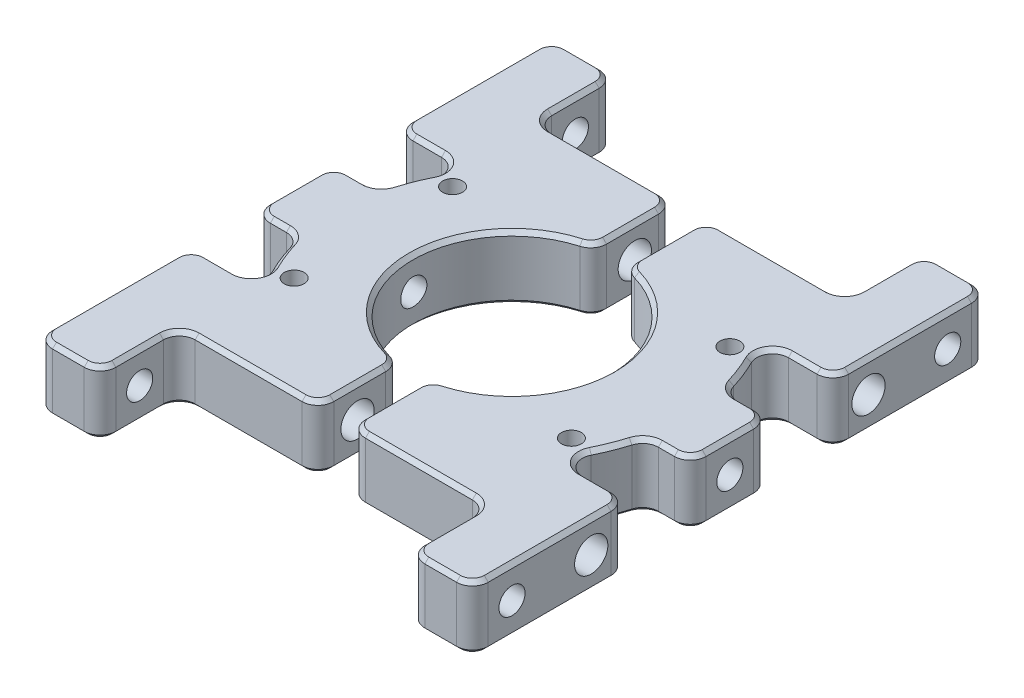
from build123d import *

# Parameters (mm, degrees)
EXTRUDE_1_DEPTH     = 4
EXTRUDE_1_2_DEPTH   = 4
SKETCH_7_W          = 8
SKETCH_7_H          = 65
EXTRUDE_2_DEPTH     = 8
SKETCH_8_R          = 2.1
SKETCH_8_R_2        = 1.5
CUT_EXTRUDE_2_DEPTH = 65.00976488
SKETCH_11_R         = 1.5
CUT_EXTRUDE_3_DEPTH = 65.009764972
SKETCH_12_R         = 1
CUT_EXTRUDE_5_DEPTH = 44.318587317
FILLET_1_R          = 2
FILLET_2_R          = 2
HOLE_WIZARD_M4_3_D  = 3.3
HOLE_WIZARD_M3_1_D  = 2.5
CHAMFER_1_SIZE      = 0.5
CHAMFER_2_SIZE      = 0.5


with BuildPart() as part:
    # 草图1 → 凸台-拉伸1 (new, symmetric)
    with BuildSketch(Plane(origin=(0, 0, 0), x_dir=(1, 0, 0), z_dir=(0, 1, 0))):
        with BuildLine():
            Line((-27.5, 22.5), (-2, 22.5))
            Line((-2, 22.5), (-2, 12.338962679))
            ThreePointArc((-2, 12.338962679), (-12.5, 0), (-2, -12.338962679))
            Line((-2, -12.338962679), (-2, -22.5))
            Line((-2, -22.5), (-27.5, -22.5))
            Line((-27.5, -22.5), (-27.5, 22.5))
        make_face()
    extrude(amount=EXTRUDE_1_DEPTH, both=True)



with BuildPart() as body_2:
    # 草图1 → Extrude 1 2 (new, symmetric)
    with BuildSketch(Plane(origin=(0, 0, 0), x_dir=(1, 0, 0), z_dir=(0, 1, 0))):
        with BuildLine():
            Line((27.5, 22.5), (27.5, -22.5))
            Line((27.5, -22.5), (2, -22.5))
            Line((2, -22.5), (2, -12.338962679))
            ThreePointArc((2, -12.338962679), (12.5, 0), (2, 12.338962679))
            Line((2, 12.338962679), (2, 22.5))
            Line((2, 22.5), (27.5, 22.5))
        make_face()
    extrude(amount=EXTRUDE_1_2_DEPTH, both=True)


with BuildPart() as part_1:
    add(part.part)

    add(body_2.part)  # 凸台-拉伸2 merges body 2
    # 草图7 → 凸台-拉伸2 (add)
    with BuildSketch(Plane(origin=(0, 4, 0), x_dir=(1, 0, 0), z_dir=(0, 1, 0))):
        with Locations((23.5, 0)):
            Rectangle(SKETCH_7_W, SKETCH_7_H)
        with Locations((-23.5, 0)):
            Rectangle(SKETCH_7_W, SKETCH_7_H)
    extrude(amount=-EXTRUDE_2_DEPTH)

    # 草图8 → 切除-拉伸2 (cut, through all)
    with BuildSketch(Plane(origin=(27.5, 0, 0), x_dir=(0, 0, -1), z_dir=(1, 0, 0))):
        with Locations((-17.5, 0)):
            Circle(SKETCH_8_R)
        with Locations((17.5, 0)):
            Circle(SKETCH_8_R)
        Circle(SKETCH_8_R_2)
    extrude(amount=-CUT_EXTRUDE_2_DEPTH, mode=Mode.SUBTRACT)

    # 草图11 → 切除-拉伸3 (cut, through all)
    with BuildSketch(Plane(origin=(27.5, 0, 0), x_dir=(0, 0, -1), z_dir=(1, 0, 0))):
        with Locations((-27.5, 0)):
            Circle(SKETCH_11_R)
        with Locations((27.5, 0)):
            Circle(SKETCH_11_R)
    extrude(amount=-CUT_EXTRUDE_3_DEPTH, mode=Mode.SUBTRACT)

    # 草图12 → 切除-拉伸5 (cut, through all)
    with BuildSketch(Plane(origin=(0, 4, 0), x_dir=(1, 0, 0), z_dir=(0, 1, 0))):
        with BuildLine():
            Line((-27.5, 13), (-27.5, 5))
            Line((-27.5, 5), (-21.937410968, 5))
            ThreePointArc((-21.937410968, 5), (-20.544058518, 9.175601321), (-18.364367672, 13))
            Line((-18.364367672, 13), (-27.5, 13))
        make_face()
        with BuildLine():
            Line((-21.937410968, -5), (-27.5, -5))
            Line((-27.5, -5), (-27.5, -13))
            Line((-27.5, -13), (-18.364367672, -13))
            ThreePointArc((-18.364367672, -13), (-20.544058518, -9.175601321), (-21.937410968, -5))
        make_face()
        with BuildLine():
            Line((27.5, -5), (21.937410968, -5))
            ThreePointArc((21.937410968, -5), (20.544058518, -9.175601321), (18.364367672, -13))
            Line((18.364367672, -13), (27.5, -13))
            Line((27.5, -13), (27.5, -5))
        make_face()
        with BuildLine():
            ThreePointArc((18.364367672, 13), (20.544058518, 9.175601321), (21.937410968, 5))
            Line((21.937410968, 5), (27.5, 5))
            Line((27.5, 5), (27.5, 13))
            Line((27.5, 13), (18.364367672, 13))
        make_face()
        with Locations(Location((-17.5, 10, 0), (0, 0, 270))):
            Circle(SKETCH_12_R)
        with Locations(Location((-17.5, -10, 0), (0, 0, 270))):
            Circle(SKETCH_12_R)
        with Locations(Location((17.5, -10, 0), (0, 0, 270))):
            Circle(SKETCH_12_R)
        with Locations(Location((17.5, 10, 0), (0, 0, 270))):
            Circle(SKETCH_12_R)
    extrude(amount=-CUT_EXTRUDE_5_DEPTH, mode=Mode.SUBTRACT)

    # 圆角1
    fillet_1_edges = [part_1.edges().sort_by_distance(p)[0] for p in [
        (21.937410968, 0, -5),
        (18.364367672, 0, -13),
        (27.5, 0, -13),
        (27.5, 0, -5),
        (19.5, 0, 32.5),
        (19.5, 0, 22.5),
        (19.5, 0, -22.5),
        (19.5, 0, -32.5),
        (27.5, 0, -32.5),
        (27.5, 0, 32.5),
        (2, 0, -12.338962679),
        (2, 0, -22.5),
        (2, 0, 22.5),
        (2, 0, 12.338962679),
        (18.364367672, 0, 13),
        (21.937410968, 0, 5),
        (27.5, 0, 5),
        (27.5, 0, 13),
    ]]
    fillet(fillet_1_edges, radius=FILLET_1_R)

    # 圆角2
    fillet_2_edges = [part_1.edges().sort_by_distance(p)[0] for p in [
        (-18.364367672, 0, -13),
        (-21.937410968, 0, -5),
        (-27.5, 0, -5),
        (-27.5, 0, -13),
        (-21.937410968, 0, 5),
        (-18.364367672, 0, 13),
        (-27.5, 0, 13),
        (-27.5, 0, 5),
        (-2, 0, 12.338962679),
        (-2, 0, 22.5),
        (-2, 0, -22.5),
        (-2, 0, -12.338962679),
        (-27.5, 0, 32.5),
        (-19.5, 0, 22.5),
        (-27.5, 0, -32.5),
        (-19.5, 0, -22.5),
        (-19.5, 0, -32.5),
        (-19.5, 0, 32.5),
    ]]
    fillet(fillet_2_edges, radius=FILLET_2_R)

    # M4 螺纹孔3 (through all)
    with Locations(Plane.ZY.offset(27.5)):
        with Locations((-27.5, 0), (0, 0), (27.5, 0)):
            Hole(HOLE_WIZARD_M4_3_D / 2)

    # M3 螺纹孔1 (through all)
    with Locations(Plane(origin=(0, 4, 0), x_dir=(1, 0, 0), z_dir=(0, 1, 0))):
        with Locations((17.5, 10), (17.5, -10), (-17.5, -10), (-17.5, 10)):
            Hole(HOLE_WIZARD_M3_1_D / 2)

    # 倒角1
    chamfer_1_edges = [part_1.edges().sort_by_distance(p)[0] for p in [
        (-27.5, 4, 0),
        (-27.5, -4, 0),
        (-24.489356882, 4, -5),
        (-24.489356882, 4, 5),
        (-20.914198985, 4, 8.297365897),
        (-23.695889639, 4, 13),
        (-27.5, 4, 22.75),
        (-23.5, 4, 32.5),
        (-19.5, 4, 27.5),
        (-10.75, 4, 22.5),
        (-2, 4, 17.218679932),
        (-12.5, 4, 0),
        (-2, 4, -17.218679932),
        (-10.75, 4, -22.5),
        (-19.5, 4, -27.5),
        (-23.5, 4, -32.5),
        (-27.5, 4, -22.75),
        (-23.695889639, 4, -13),
        (-20.914198985, 4, -8.297365897),
        (-26.914213562, 4, -13.585786438),
        (-26.914213562, 4, -4.414213562),
        (-26.914213562, 4, -31.914213562),
        (-20.085786438, 4, -31.914213562),
        (-2.585786438, 4, -21.914213562),
        (-2.4025883, 4, -12.733916529),
        (-2.4025883, 4, 12.733916529),
        (-2.585786438, 4, 21.914213562),
        (-20.085786438, 4, 31.914213562),
        (-26.914213562, 4, 31.914213562),
        (-26.914213562, 4, 13.585786438),
        (-26.914213562, 4, 4.414213562),
        (-24.489356882, -4, 5),
        (-24.489356882, -4, -5),
        (-20.914198985, -4, -8.297365897),
        (-23.695889639, -4, -13),
        (-27.5, -4, -22.75),
        (-23.5, -4, -32.5),
        (-19.5, -4, -27.5),
        (-10.75, -4, -22.5),
        (-2, -4, -17.218679932),
        (-12.5, -4, 0),
        (-2, -4, 17.218679932),
        (-10.75, -4, 22.5),
        (-19.5, -4, 27.5),
        (-23.5, -4, 32.5),
        (-27.5, -4, 22.75),
        (-23.695889639, -4, 13),
        (-20.914198985, -4, 8.297365897),
        (-26.914213562, -4, -13.585786438),
        (-26.914213562, -4, -4.414213562),
        (-26.914213562, -4, -31.914213562),
        (-20.085786438, -4, -31.914213562),
        (-2.585786438, -4, -21.914213562),
        (-2.4025883, -4, -12.733916529),
        (-2.4025883, -4, 12.733916529),
        (-2.585786438, -4, 21.914213562),
        (-20.085786438, -4, 31.914213562),
        (-26.914213562, -4, 31.914213562),
        (-26.914213562, -4, 13.585786438),
        (-26.914213562, -4, 4.414213562),
        (-22.283485154, 4, 5.396432549),
        (-22.283485154, -4, 5.396432549),
        (-20.189439952, 4, 12.049781318),
        (-20.189439952, -4, 12.049781318),
        (-18.914213562, -4, 23.085786438),
        (-18.914213562, 4, 23.085786438),
        (-18.914213562, -4, -23.085786438),
        (-18.914213562, 4, -23.085786438),
        (-20.189439952, 4, -12.049781318),
        (-20.189439952, -4, -12.049781318),
        (-22.283485154, 4, -5.396432549),
        (-22.283485154, -4, -5.396432549),
    ]]
    chamfer(chamfer_1_edges, length=CHAMFER_1_SIZE)

    # 倒角2
    chamfer_2_edges = [part_1.edges().sort_by_distance(p)[0] for p in [
        (24.489356882, 4, 5),
        (24.489356882, -4, 5),
        (20.914198985, 4, 8.297365897),
        (27.5, 4, 0),
        (24.489356882, 4, -5),
        (20.914198985, 4, -8.297365897),
        (23.695889639, 4, -13),
        (27.5, 4, -22.75),
        (23.5, 4, -32.5),
        (19.5, 4, -27.5),
        (10.75, 4, -22.5),
        (2, 4, -17.218679932),
        (12.5, 4, 0),
        (2, 4, 17.218679932),
        (10.75, 4, 22.5),
        (19.5, 4, 27.5),
        (23.5, 4, 32.5),
        (27.5, 4, 22.75),
        (23.695889639, 4, 13),
        (26.914213562, 4, 31.914213562),
        (26.914213562, 4, 13.585786438),
        (20.085786438, 4, 31.914213562),
        (2.585786438, 4, 21.914213562),
        (2.4025883, 4, 12.733916529),
        (2.4025883, 4, -12.733916529),
        (2.585786438, 4, -21.914213562),
        (20.085786438, 4, -31.914213562),
        (26.914213562, 4, -31.914213562),
        (26.914213562, 4, -13.585786438),
        (26.914213562, 4, -4.414213562),
        (26.914213562, 4, 4.414213562),
        (27.5, -4, 0),
        (20.914198985, -4, 8.297365897),
        (23.695889639, -4, 13),
        (27.5, -4, 22.75),
        (23.5, -4, 32.5),
        (19.5, -4, 27.5),
        (10.75, -4, 22.5),
        (2, -4, 17.218679932),
        (12.5, -4, 0),
        (2, -4, -17.218679932),
        (10.75, -4, -22.5),
        (19.5, -4, -27.5),
        (23.5, -4, -32.5),
        (27.5, -4, -22.75),
        (23.695889639, -4, -13),
        (20.914198985, -4, -8.297365897),
        (24.489356882, -4, -5),
        (26.914213562, -4, 31.914213562),
        (26.914213562, -4, 13.585786438),
        (20.085786438, -4, 31.914213562),
        (2.585786438, -4, 21.914213562),
        (2.4025883, -4, 12.733916529),
        (2.4025883, -4, -12.733916529),
        (2.585786438, -4, -21.914213562),
        (20.085786438, -4, -31.914213562),
        (26.914213562, -4, -31.914213562),
        (26.914213562, -4, -13.585786438),
        (26.914213562, -4, -4.414213562),
        (26.914213562, -4, 4.414213562),
        (22.283485154, 4, -5.396432549),
        (22.283485154, -4, -5.396432549),
        (20.189439952, 4, -12.049781318),
        (20.189439952, -4, -12.049781318),
        (18.914213562, 4, -23.085786438),
        (18.914213562, -4, -23.085786438),
        (18.914213562, 4, 23.085786438),
        (18.914213562, -4, 23.085786438),
        (20.189439952, 4, 12.049781318),
        (20.189439952, -4, 12.049781318),
        (22.283485154, 4, 5.396432549),
        (22.283485154, -4, 5.396432549),
    ]]
    chamfer(chamfer_2_edges, length=CHAMFER_2_SIZE)


solid = part_1.part
